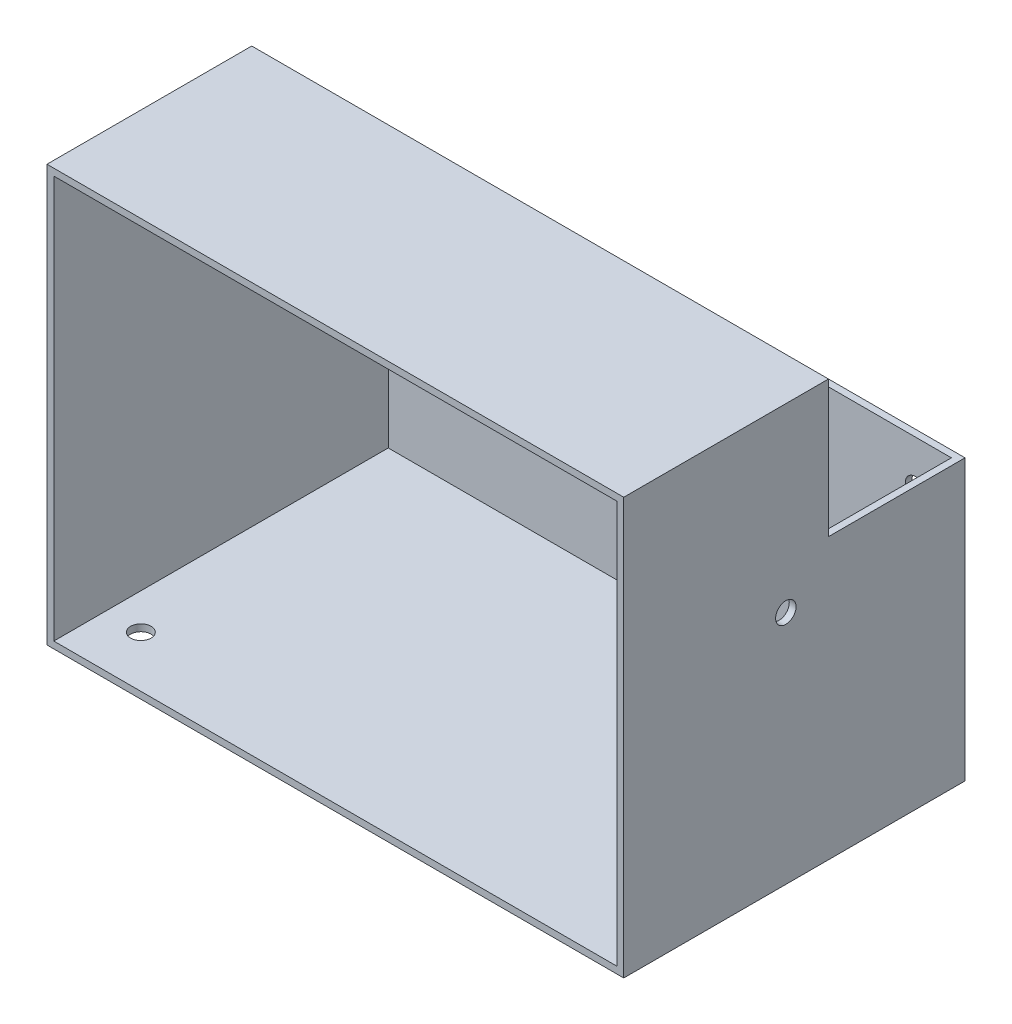
from build123d import *

# Parameters (mm, degrees)
SKETCH_2_W          = 169
SKETCH_2_H          = 100
EXTRUDE_2_DEPTH     = 122
SKETCH_6_W          = 165
SKETCH_6_H          = 118
CUT_EXTRUDE_3_DEPTH = 98
SKETCH_7_W          = 40
SKETCH_7_H          = 40
CUT_EXTRUDE_4_DEPTH = 215.347848135
SKETCH_8_R          = 3
CUT_EXTRUDE_5_DEPTH = 10
SKETCH_9_R          = 3
CUT_EXTRUDE_6_DEPTH = 10
SKETCH_10_R         = 3
CUT_EXTRUDE_7_DEPTH = 10


with BuildPart() as part:
    # ｽｹｯﾁ2 → ﾎﾞｽ - 押し出し2 (new body)
    with BuildSketch(Plane(origin=(0, 0, 0), x_dir=(1, 0, 0), z_dir=(0, 1, 0))):
        Rectangle(SKETCH_2_W, SKETCH_2_H)
    extrude(amount=EXTRUDE_2_DEPTH)

    # ｽｹｯﾁ6 → ｶｯﾄ - 押し出し3 (cut)
    with BuildSketch(Plane.XY.offset(50)):
        with Locations((0, 61)):
            Rectangle(SKETCH_6_W, SKETCH_6_H)
    extrude(amount=-CUT_EXTRUDE_3_DEPTH, mode=Mode.SUBTRACT)

    # ｽｹｯﾁ7 → ｶｯﾄ - 押し出し4 (cut, through all)
    with BuildSketch(Plane(origin=(84.5, 0, 0), x_dir=(0, 0, -1), z_dir=(1, 0, 0))):
        with Locations((30, 102)):
            Rectangle(SKETCH_7_W, SKETCH_7_H)
    extrude(amount=-CUT_EXTRUDE_4_DEPTH, mode=Mode.SUBTRACT)

    # ｽｹｯﾁ8 → ｶｯﾄ - 押し出し5 (cut)
    with BuildSketch(Plane(origin=(0, 2, 0), x_dir=(1, 0, 0), z_dir=(0, 1, 0))):
        with Locations(Location((-72, -35, 0), (0, 0, 270))):
            Circle(SKETCH_8_R)
        with Locations(Location((72, -35, 0), (0, 0, 270))):
            Circle(SKETCH_8_R)
    extrude(amount=-CUT_EXTRUDE_5_DEPTH, mode=Mode.SUBTRACT)

    # ｽｹｯﾁ9 → ｶｯﾄ - 押し出し6 (cut)
    with BuildSketch(Plane.XY.offset(-48)):
        with Locations((-72, 67)):
            Circle(SKETCH_9_R)
        with Locations((72, 69)):
            Circle(SKETCH_9_R)
    extrude(amount=-CUT_EXTRUDE_6_DEPTH, mode=Mode.SUBTRACT)

    # ｽｹｯﾁ10 → ｶｯﾄ - 押し出し7 (cut)
    with BuildSketch(Plane(origin=(84.5, 0, 0), x_dir=(0, 0, -1), z_dir=(1, 0, 0))):
        with Locations((-2.5, 69)):
            Circle(SKETCH_10_R)
    extrude(amount=-CUT_EXTRUDE_7_DEPTH, mode=Mode.SUBTRACT)


solid = part.part
